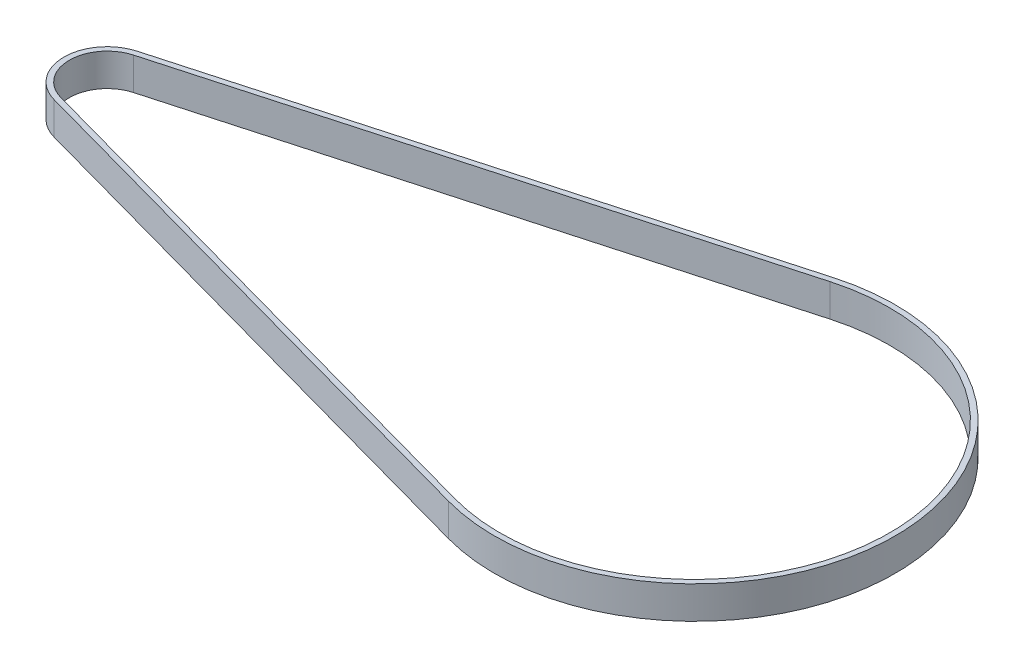
from build123d import *

# Parameters (mm, degrees)
BOSS_EXTRUDE1_DEPTH = 6


with BuildPart() as part:
    # Sketch1 → Boss-Extrude1 (new body)
    with BuildSketch(Plane(origin=(0, 0, 0), x_dir=(1, 0, 0), z_dir=(0, 1, 0))):
        with BuildLine():
            Line((1.807996662, -7.65036043), (102.446988033, -35.453266004))
            ThreePointArc((102.446988033, -35.453266004), (149.299637462, 0.262003402), (102.348289541, 35.84742395))
            Line((102.348289541, 35.84742395), (1.786656447, 7.766004966))
            ThreePointArc((1.786656447, 7.766004966), (-4.06168543, 0.049711888), (1.807996662, -7.65036043))
        make_face()
        with BuildLine():
            Line((2.074285442, -6.686467134), (102.713276814, -34.489372708))
            ThreePointArc((102.713276814, -34.489372708), (148.29963842, 0.260619146), (102.617245848, 34.884271571))
            Line((102.617245848, 34.884271571), (2.055612755, 6.802852587))
            ThreePointArc((2.055612755, 6.802852587), (-3.061686388, 0.051096144), (2.074285442, -6.686467134))
        make_face(mode=Mode.SUBTRACT)
    extrude(amount=BOSS_EXTRUDE1_DEPTH)


solid = part.part
